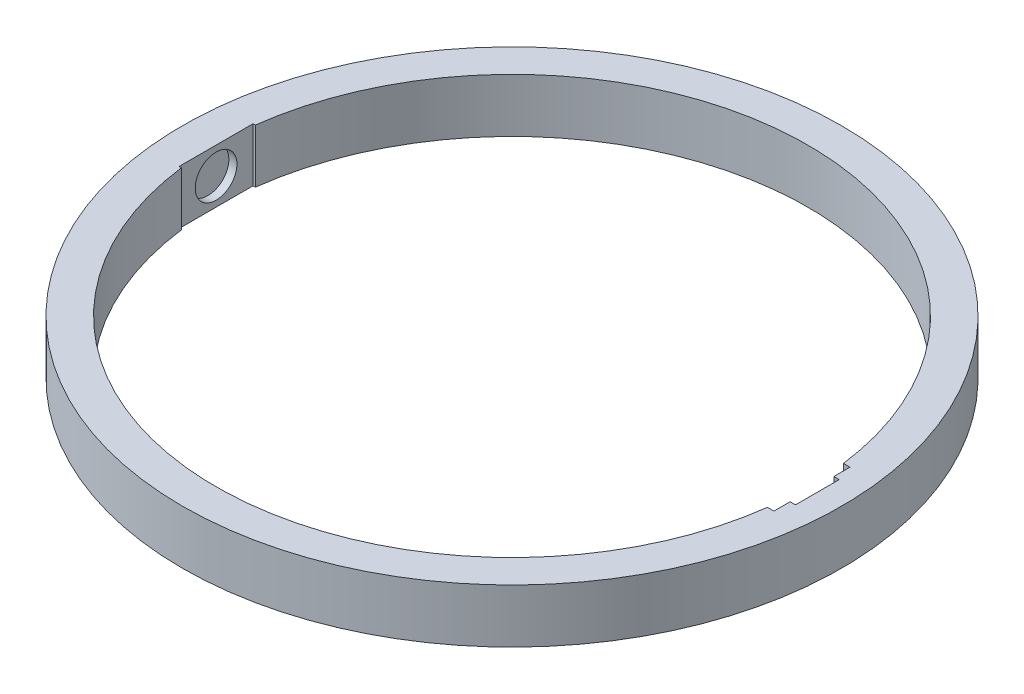
from build123d import *

# Parameters (mm, degrees)
SKETCH1_R               = 490
SKETCH1_R_2             = 440
BOSS_EXTRUDE1_DEPTH     = 80
CUT_EXTRUDE2_DEPTH      = 698.567201064
CUT_EXTRUDE2_DEPTH_BACK = 698.567201064
SKETCH4_W               = 110
SKETCH4_H               = 80
CUT_EXTRUDE3_DEPTH      = 10
SKETCH5_R               = 31
CUT_EXTRUDE4_DEPTH      = 12


with BuildPart() as part:
    # Sketch1 → Boss-Extrude1 (new body)
    with BuildSketch(Plane(origin=(0, 0, 0), x_dir=(1, 0, 0), z_dir=(0, 1, 0))):
        with Locations(Location((0, 0, 0), (0, 0, 270))):
            Circle(SKETCH1_R)
        with Locations(Location((0, 0, 0), (0, 0, 270))):
            Circle(SKETCH1_R_2, mode=Mode.SUBTRACT)
    extrude(amount=BOSS_EXTRUDE1_DEPTH)

    # Sketch3 → Cut-Extrude2 (cut, two sides: drawn at the far end of the back side and taken through both)
    with BuildSketch(Plane(origin=(0, 80, 0), x_dir=(1, 0, 0), z_dir=(0, 1, 0)).offset(-CUT_EXTRUDE2_DEPTH_BACK)):
        Polygon((446, 32.5), (454, 32.5), (454, -32.5), (446, -32.5), (446, -56.5), (366.03, -56.5), (366.03, 56.5), (446, 56.5), align=None)
    extrude(amount=CUT_EXTRUDE2_DEPTH + CUT_EXTRUDE2_DEPTH_BACK, mode=Mode.SUBTRACT)

    # Sketch4 → Cut-Extrude3 (cut)
    with BuildSketch(Plane(origin=(-440, 0, 0), x_dir=(0, 0, -1), z_dir=(1, 0, 0))):
        with Locations((0, 40)):
            Rectangle(SKETCH4_W, SKETCH4_H)
    extrude(amount=CUT_EXTRUDE3_DEPTH, mode=Mode.SUBTRACT)

    # Sketch5 → Cut-Extrude4 (cut)
    with BuildSketch(Plane(origin=(-440, 0, 0), x_dir=(0, 0, -1), z_dir=(1, 0, 0))):
        with Locations((0, 40)):
            Circle(SKETCH5_R)
    extrude(amount=-CUT_EXTRUDE4_DEPTH, mode=Mode.SUBTRACT)


solid = part.part
